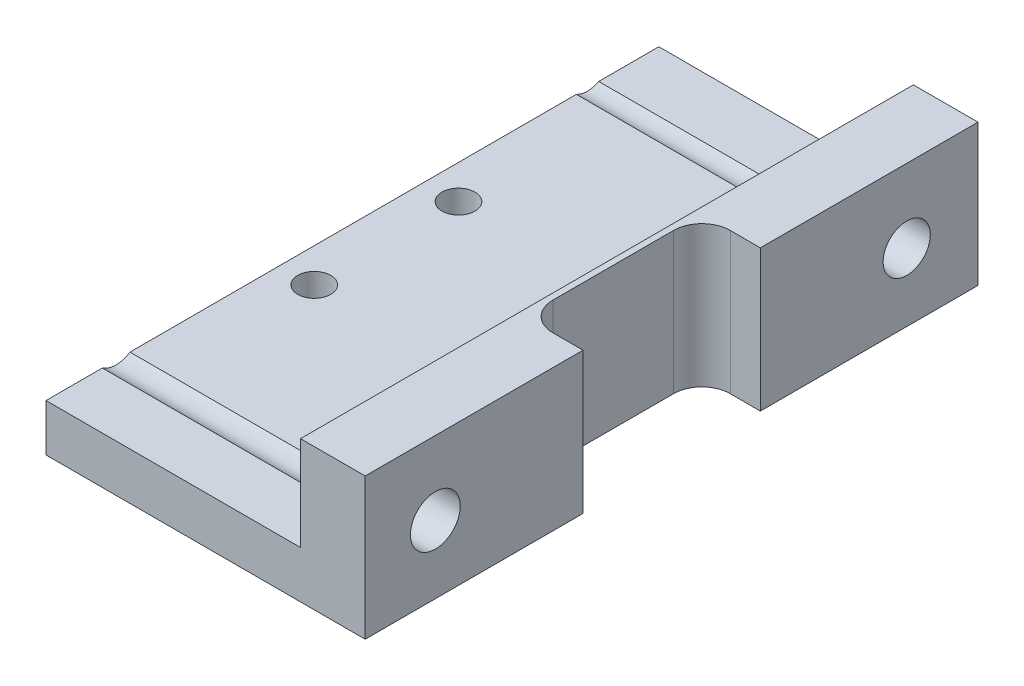
from build123d import *

# Parameters (mm, degrees)
SALIENTE_EXTRUIR1_DEPTH = 15
CROQUIS3_W              = 27
CROQUIS3_H              = 10
CORTAR_EXTRUIR1_DEPTH   = 103
CROQUIS2_R              = 1.75
CORTAR_EXTRUIR2_DEPTH   = 25.85
CROQUIS4_R              = 2.5
CROQUIS4_R_2            = 2.643656248
CORTAR_EXTRUIR3_DEPTH   = 34


with BuildPart() as part:
    # Croquis1 → Saliente-Extruir1 (new body)
    with BuildSketch(Plane(origin=(0, 0, 0), x_dir=(1, 0, 0), z_dir=(0, 1, 0))):
        with BuildLine():
            Line((10.672482707, -9.762077578), (7.472477359, -9.762077578))
            ThreePointArc((7.472477359, -9.762077578), (5.351157015, -8.883397922), (4.472477359, -6.762077578))
            Line((4.472477359, -6.762077578), (4.472477359, 6.050505251))
            ThreePointArc((4.472477359, 6.050505251), (5.354589632, 8.175252666), (7.48217841, 9.050489566))
            Line((7.48217841, 9.050489566), (10.672482707, 9.040173078))
            Line((10.672482707, 9.040173078), (10.672482707, 32.133052813))
            Line((10.672482707, 32.133052813), (-23.183050508, 32.133052813))
            Line((-23.183050508, 32.133052813), (-23.183050508, -32.8682401))
            Line((-23.183050508, -32.8682401), (10.672482707, -32.8682401))
            Line((10.672482707, -32.8682401), (10.672482707, -9.762077578))
        make_face()
    extrude(amount=SALIENTE_EXTRUIR1_DEPTH)

    # Croquis3 → Cortar-Extruir1 (cut)
    with BuildSketch(Plane(origin=(0, 0, -32.133052813), x_dir=(-1, 0, 0), z_dir=(0, 0, -1))):
        with Locations((9.683050508, 10)):
            Rectangle(CROQUIS3_W, CROQUIS3_H)
    extrude(amount=-CORTAR_EXTRUIR1_DEPTH, mode=Mode.SUBTRACT)

    # Croquis2 → Cortar-Extruir2 (cut)
    with BuildSketch(Plane.XZ):
        with Locations(Location((0.416949492, -7.282406356, 0), (0, 0, 270))):
            Circle(CROQUIS2_R)
        with Locations(Location((-19.583050508, -7.282406356, 0), (0, 0, 270))):
            Circle(CROQUIS2_R)
        with Locations((-19.583050508, 8.017593644)):
            Circle(CROQUIS2_R)
        with Locations((0.416949492, 8.017593644)):
            Circle(CROQUIS2_R)
    extrude(amount=-CORTAR_EXTRUIR2_DEPTH, mode=Mode.SUBTRACT)

    # Croquis4 → Cortar-Extruir3 (cut)
    with BuildSketch(Plane(origin=(10.672482707, 0, 0), x_dir=(0, 0, -1), z_dir=(1, 0, 0))):
        with Locations((24.573974701, 7.201679741)):
            Circle(CROQUIS4_R)
        with Locations((-25.426025299, 7.201679741)):
            Circle(CROQUIS4_R_2)
    extrude(amount=-CORTAR_EXTRUIR3_DEPTH, mode=Mode.SUBTRACT)


solid = part.part
